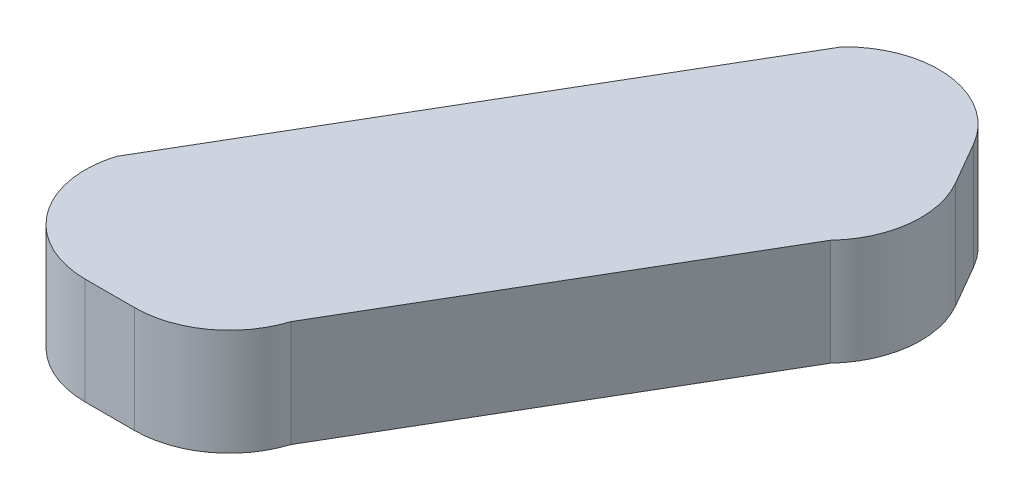
from build123d import *

# Parameters (mm, degrees)
BOSS_EXTRUDE1_DEPTH = 4.5


with BuildPart() as part:
    # Sketch1 → Boss-Extrude1 (new, symmetric)
    with BuildSketch(Plane(origin=(0, 0, 0), x_dir=(1, 0, 0), z_dir=(0, 1, 0))):
        with BuildLine():
            Line((-53.583601177, 60.80951969), (-55.668486055, 64.420646227))
            ThreePointArc((-55.668486055, 64.420646227), (-61.622662682, 68.361129347), (-68.352706691, 65.97656772))
            Line((-68.352706691, 65.97656772), (-90.993256658, 27.298850575))
            ThreePointArc((-90.993256658, 27.298850575), (-89.749031081, 20.224584028), (-83.330666624, 17))
            Line((-83.330666624, 17), (-79.14543575, 17))
            ThreePointArc((-79.14543575, 17), (-74.41664671, 18.547205705), (-71.516960015, 22.590361446))
            Line((-71.516960015, 22.590361446), (-54.679341331, 51.333903335))
            ThreePointArc((-54.679341331, 51.333903335), (-52.564762349, 55.890540621), (-53.583601177, 60.80951969))
        make_face()
    extrude(amount=BOSS_EXTRUDE1_DEPTH, both=True)


solid = part.part
